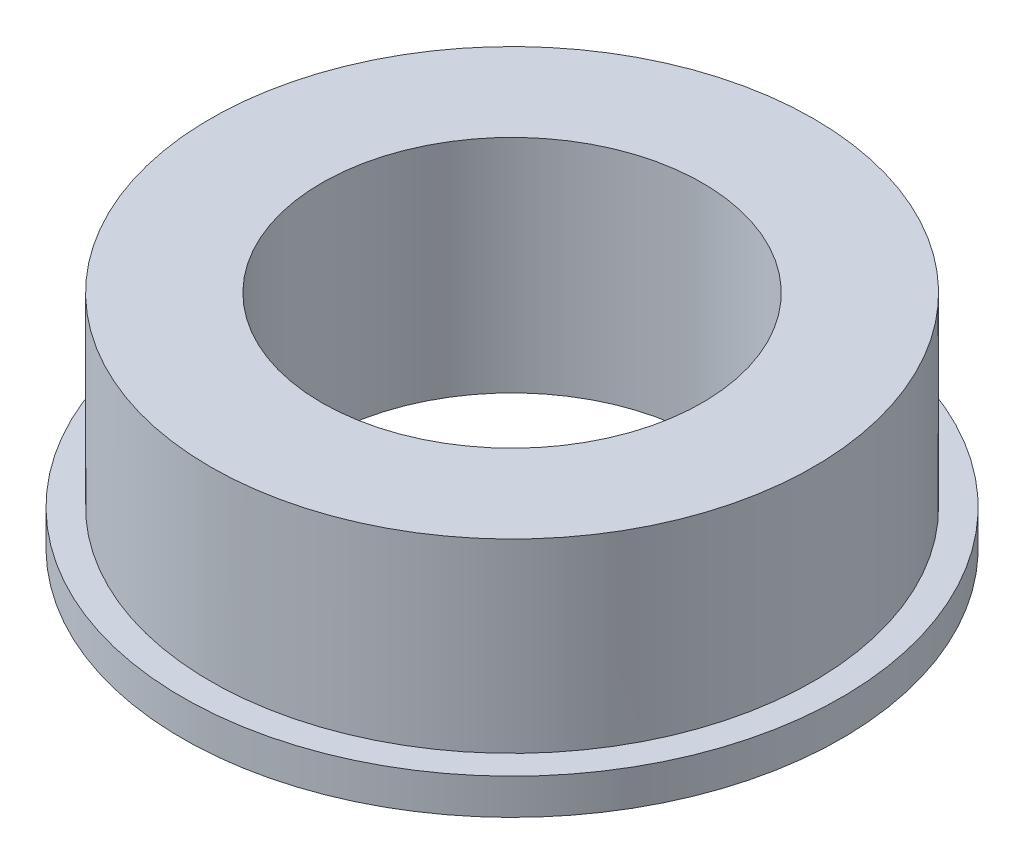
from build123d import *

# Parameters (mm, degrees)
SKETCH1_R           = 6.3373
SKETCH1_R_2         = 4
BOSS_EXTRUDE1_DEPTH = 4.65
SKETCH2_R           = 6.925
SKETCH2_R_2         = 4
BOSS_EXTRUDE2_DEPTH = 0.75


with BuildPart() as part:
    # Sketch1 → Boss-Extrude1 (new body)
    with BuildSketch(Plane(origin=(0, 0, 0), x_dir=(1, 0, 0), z_dir=(0, 1, 0))):
        with Locations(Location((0, 0, 0), (0, 0, 270))):
            Circle(SKETCH1_R)
        with Locations(Location((0, 0, 0), (0, 0, 270))):
            Circle(SKETCH1_R_2, mode=Mode.SUBTRACT)
    extrude(amount=BOSS_EXTRUDE1_DEPTH)

    # Sketch2 → Boss-Extrude2 (add)
    with BuildSketch(Plane.XZ):
        with Locations(Location((0, 0, 0), (0, 0, 270))):
            Circle(SKETCH2_R)
        with Locations(Location((0, 0, 0), (0, 0, 90))):
            Circle(SKETCH2_R_2, mode=Mode.SUBTRACT)
    extrude(amount=-BOSS_EXTRUDE2_DEPTH)


solid = part.part
